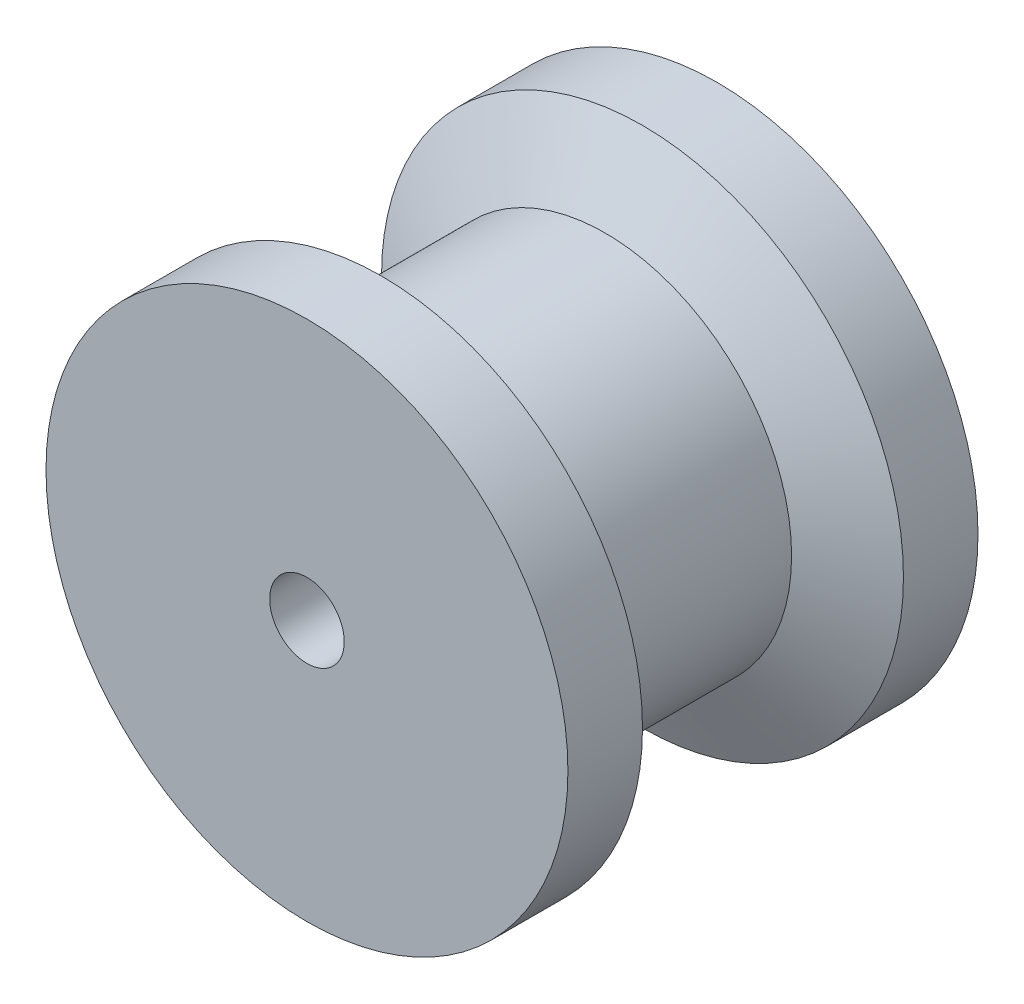
from build123d import *

# Parameters (mm, degrees)
SKETCH1_R           = 7
SKETCH1_R_2         = 1
BOSS_EXTRUDE1_DEPTH = 11


with BuildPart() as part:
    # Sketch1 → Boss-Extrude1 (new body)
    with BuildSketch(Plane.XY):
        Circle(SKETCH1_R)
        Circle(SKETCH1_R_2, mode=Mode.SUBTRACT)
    extrude(amount=BOSS_EXTRUDE1_DEPTH)

    # Sketch4 → Cut-Revolve1 (revolve, cut)
    with BuildSketch(Plane(origin=(0, 0, 0), x_dir=(0, 0, -1), z_dir=(1, 0, 0))):
        Polygon((-2, 7), (-3, 5), (-8, 5), (-9, 7), align=None)
    revolve(axis=Axis((0, 0, 1000), (0, 0, -1)), mode=Mode.SUBTRACT)


solid = part.part
